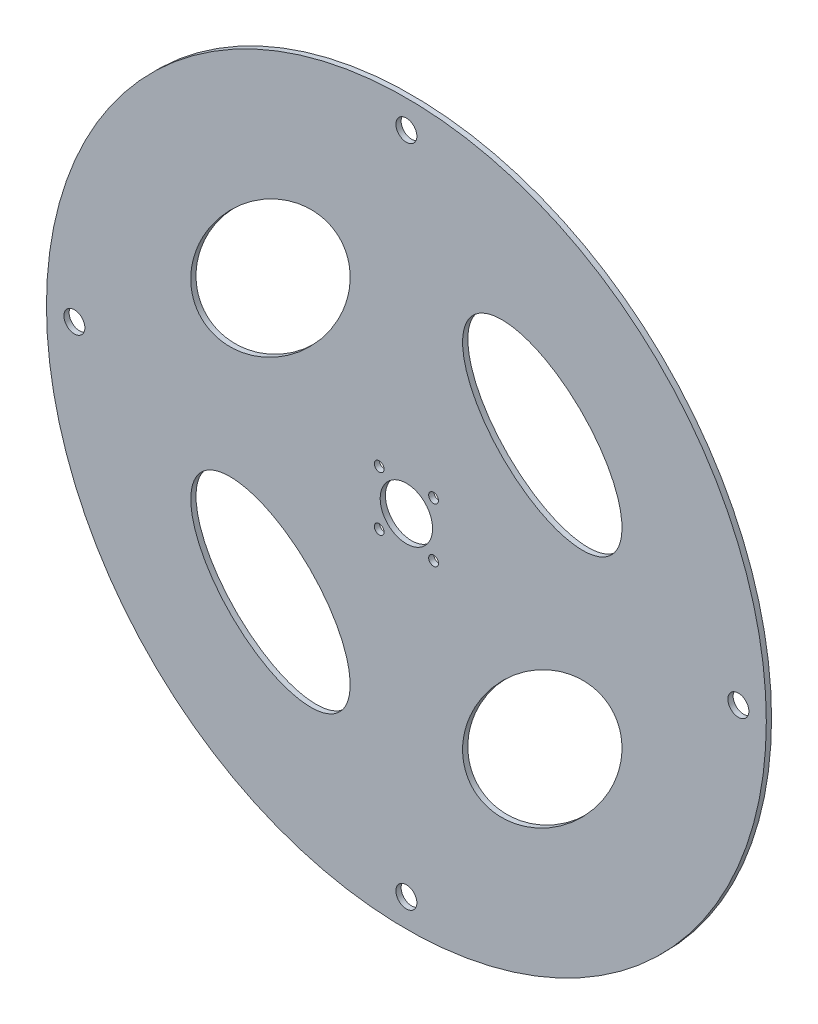
from build123d import *

# Parameters (mm, degrees)
SKETCH1_R          = 103
BASE_DISC_DEPTH    = 1.5
SKETCH3_R          = 3
CUT_EXTRUDE1_DEPTH = 146.671719973
SKETCH4_RX         = 28
SKETCH4_RY         = 16
CUT_EXTRUDE2_DEPTH = 146.671719973
SKETCH2_R          = 7.5
CUT_EXTRUDE3_DEPTH = 146.671720116
CIRPATTERN3_COUNT  = 4
CIRPATTERN4_COUNT  = 4
SKETCH5_R          = 1.4
CUT_EXTRUDE4_DEPTH = 146.671720116


with BuildPart() as part:
    # Sketch1 → Base Disc (new body)
    with BuildSketch(Plane.XY):
        Circle(SKETCH1_R)
    extrude(amount=BASE_DISC_DEPTH)

    # Sketch3 → Cut-Extrude1 (cut, through all)
    with BuildSketch(Plane(origin=(0, 0, 0), x_dir=(-1, 0, 0), z_dir=(0, 0, -1))):
        with Locations((95, 0)):
            Circle(SKETCH3_R)
    cut_extrude1 = extrude(amount=-CUT_EXTRUDE1_DEPTH, mode=Mode.SUBTRACT)

    # Sketch4 → Cut-Extrude2 (cut, through all)
    with BuildSketch(Plane(origin=(0, 0, 0), x_dir=(-1, 0, 0), z_dir=(0, 0, -1))):
        with Locations(Location((38.890872965, 38.890872965), (0, 0, 135))):
            Ellipse(SKETCH4_RX, SKETCH4_RY)
    cut_extrude2 = extrude(amount=-CUT_EXTRUDE2_DEPTH, mode=Mode.SUBTRACT)

    # Sketch2 → Cut-Extrude3 (cut, through all)
    with BuildSketch(Plane(origin=(0, 0, 0), x_dir=(-1, 0, 0), z_dir=(0, 0, -1))):
        Circle(SKETCH2_R)
    extrude(amount=-CUT_EXTRUDE3_DEPTH, mode=Mode.SUBTRACT)

    # CirPattern3: Cut-Extrude1 ×4 about axis
    cirpattern3_axis = Axis((0, 0, 0), (0, 0, 1))
    for i in range(1, CIRPATTERN3_COUNT):
        add(cut_extrude1.rotate(cirpattern3_axis, i * 360 / CIRPATTERN3_COUNT), mode=Mode.SUBTRACT)

    # CirPattern4: Cut-Extrude2 ×4 about axis
    cirpattern4_axis = Axis((0, 0, 0), (0, 0, -1))
    for i in range(1, CIRPATTERN4_COUNT):
        add(cut_extrude2.rotate(cirpattern4_axis, i * 360 / CIRPATTERN4_COUNT), mode=Mode.SUBTRACT)

    # Sketch5 → Cut-Extrude4 (cut, through all)
    with BuildSketch(Plane.XY):
        with Locations((-7.778174593, -7.778174593)):
            Circle(SKETCH5_R)
        with Locations((-7.778174593, 7.778174593)):
            Circle(SKETCH5_R)
        with Locations((7.778174593, 7.778174593)):
            Circle(SKETCH5_R)
        with Locations((7.778174593, -7.778174593)):
            Circle(SKETCH5_R)
    extrude(amount=CUT_EXTRUDE4_DEPTH, mode=Mode.SUBTRACT)


solid = part.part
